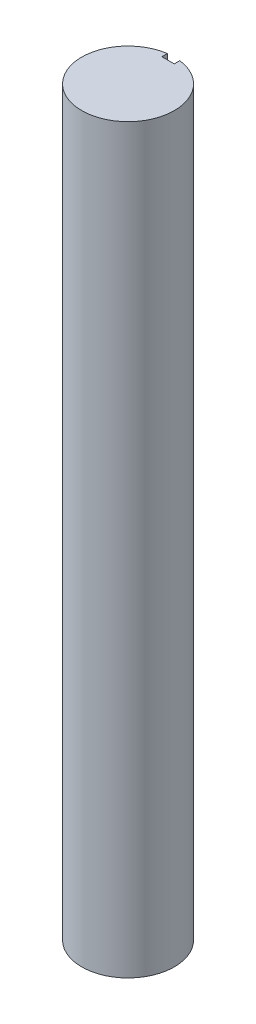
from build123d import *

# Parameters (mm, degrees)
BOSS_EXTRUDE1_DEPTH = 101.6


with BuildPart() as part:
    # Sketch1 → Boss-Extrude1 (new body)
    with BuildSketch(Plane(origin=(0, 0, 0), x_dir=(1, 0, 0), z_dir=(0, 1, 0))):
        with BuildLine():
            Line((-0.908611122, 6.284657972), (-0.908611122, 5.534751173))
            Line((-0.908611122, 5.534751173), (0.797392484, 5.534751173))
            Line((0.797392484, 5.534751173), (0.797392484, 6.29973533))
            ThreePointArc((0.797392484, 6.29973533), (0.056117983, -6.349752024), (-0.908611122, 6.284657972))
        make_face()
    extrude(amount=BOSS_EXTRUDE1_DEPTH)


solid = part.part
